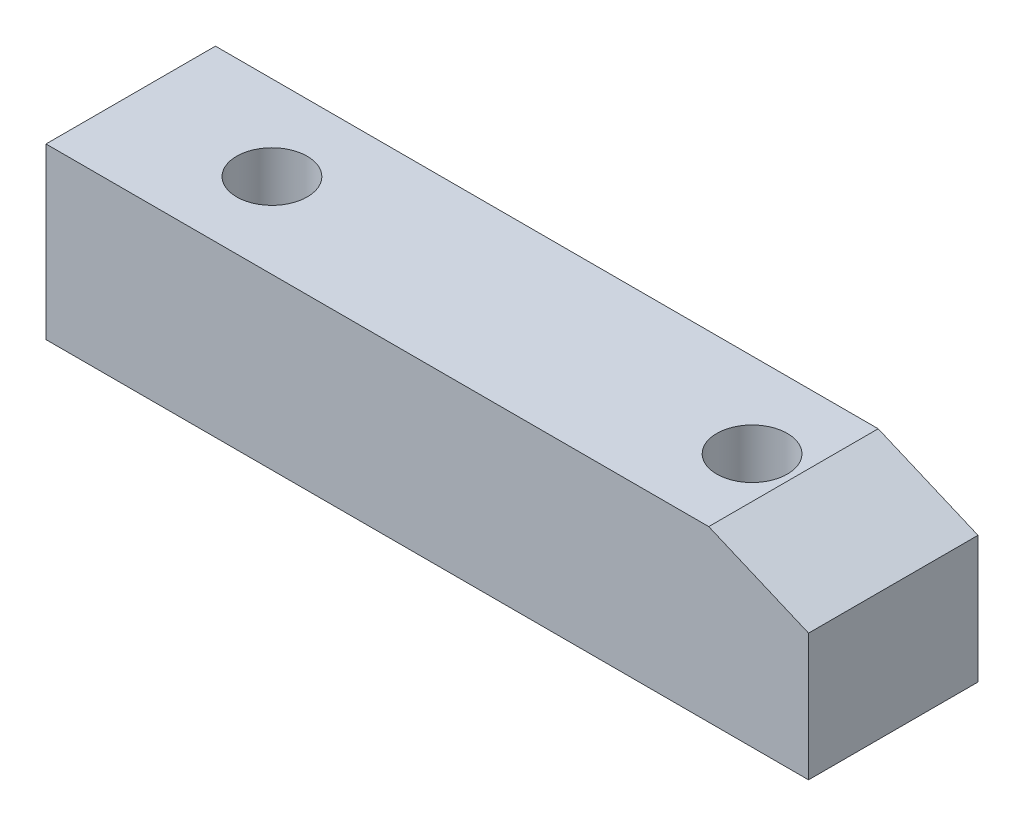
from build123d import *

# Parameters (mm, degrees)
ESQUISSE1_W           = 27
ESQUISSE1_H           = 6
BOSS_EXTRU_1_DEPTH    = 6
TROU_TARAUD_M31_D     = 2.5
TROU_TARAUD_M31_DEPTH = 8.5
TROU_TARAUD_M31_TIP   = 0.751075774
CHANFREIN1_SIZE       = 1.5
CHANFREIN1_SIZE2      = 3.533778549


with BuildPart() as part:
    # Esquisse1 → Boss.-Extru.1 (new body)
    with BuildSketch(Plane.XY):
        with Locations((13.5, -3)):
            Rectangle(ESQUISSE1_W, ESQUISSE1_H)
    extrude(amount=BOSS_EXTRU_1_DEPTH)

    # Trou taraudé M31
    with Locations(Plane(origin=(5, 0, 3), x_dir=(0, 0, 1), z_dir=(0, 1, 0))):
        with Locations((0, 0), (0, 17)):
            Hole(TROU_TARAUD_M31_D / 2, depth=TROU_TARAUD_M31_DEPTH)
            with Locations((0, 0, -(TROU_TARAUD_M31_DEPTH + TROU_TARAUD_M31_TIP / 2))):  # 118° drill point
                Cone(0, TROU_TARAUD_M31_D / 2, TROU_TARAUD_M31_TIP, mode=Mode.SUBTRACT)

    # Chanfrein1
    chanfrein1_edges = [part.edges().sort_by_distance(p)[0] for p in [
        (27, 0, 3),
    ]]
    chanfrein1_side = [part.faces().sort_by_distance(p)[0] for p in [
        (27, -3, 3),
    ]]
    chamfer(chanfrein1_edges, length=CHANFREIN1_SIZE, length2=CHANFREIN1_SIZE2, reference=chanfrein1_side[0])


solid = part.part
